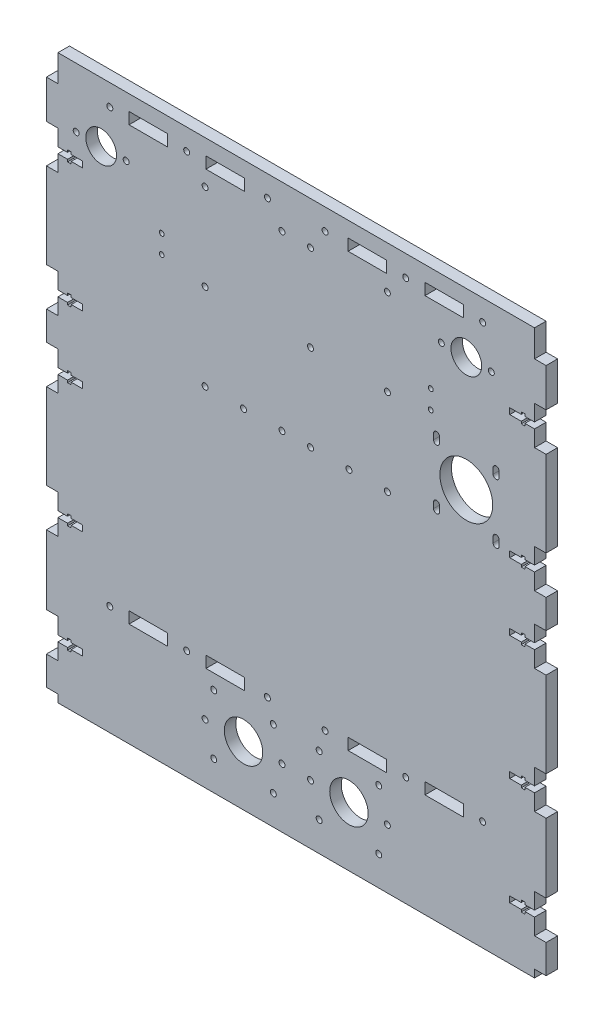
from build123d import *

# Parameters (mm, degrees)
SKETCH1_W           = 260
SKETCH1_H           = 270
BOSS_EXTRUDE1_DEPTH = 6
SKETCH2_W           = 20
SKETCH2_H           = 6
CUT_EXTRUDE1_DEPTH  = 6
SKETCH3_W           = 6
SKETCH3_H           = 20
CUT_EXTRUDE2_DEPTH  = 10
SKETCH4_R           = 8
CUT_EXTRUDE3_DEPTH  = 10
SKETCH5_R           = 8
SKETCH5_R_2         = 1.55
CUT_EXTRUDE4_DEPTH  = 6
SKETCH6_W           = 260
SKETCH6_H           = 6
BOSS_EXTRUDE2_DEPTH = 5
SKETCH7_R           = 13.75
CUT_EXTRUDE5_DEPTH  = 16
CUT_EXTRUDE6_DEPTH  = 10
SKETCH9_R           = 1.55
CUT_EXTRUDE7_DEPTH  = 10
BOSS_EXTRUDE3_DEPTH = 6
SKETCH11_R          = 1.55
SKETCH11_R_2        = 10
CUT_EXTRUDE9_DEPTH  = 10
SKETCH13_W          = 248
SKETCH13_H          = 6
BOSS_EXTRUDE4_DEPTH = 14
SKETCH14_W          = 248
SKETCH14_H          = 6
BOSS_EXTRUDE5_DEPTH = 4
SKETCH15_R          = 1.55
SKETCH15_W          = 20
SKETCH15_H          = 6
CUT_EXTRUDE10_DEPTH = 10
SKETCH16_R          = 1.25
CUT_EXTRUDE11_DEPTH = 10


with BuildPart() as part:
    # Sketch1 → Boss-Extrude1 (new body)
    with BuildSketch(Plane.XY):
        with Locations((130, 135)):
            Rectangle(SKETCH1_W, SKETCH1_H)
    extrude(amount=BOSS_EXTRUDE1_DEPTH)

    # Sketch2 → Cut-Extrude1 (cut)
    with BuildSketch(Plane(origin=(0, 0, 0), x_dir=(-1, 0, 0), z_dir=(0, 0, -1))):
        with Locations((-207, 53)):
            Rectangle(SKETCH2_W, SKETCH2_H)
        with Locations((-167, 53)):
            Rectangle(SKETCH2_W, SKETCH2_H)
        with BuildLine():
            Line((-220, 0), (-40, 0))
            ThreePointArc((-40, 0), (-130, 10), (-220, 0))
        make_face()
        with Locations((-93, 53)):
            Rectangle(SKETCH2_W, SKETCH2_H)
        with Locations((-53, 53)):
            Rectangle(SKETCH2_W, SKETCH2_H)
    extrude(amount=-CUT_EXTRUDE1_DEPTH, mode=Mode.SUBTRACT)

    # Sketch3 → Cut-Extrude2 (cut)
    with BuildSketch(Plane(origin=(0, 0, 0), x_dir=(-1, 0, 0), z_dir=(0, 0, -1))):
        with Locations((-257, 245)):
            Rectangle(SKETCH3_W, SKETCH3_H)
        with Locations((-257, 25)):
            Rectangle(SKETCH3_W, SKETCH3_H)
        with Locations((-257, 81)):
            Rectangle(SKETCH3_W, SKETCH3_H)
        with Locations((-257, 145.5)):
            Rectangle(SKETCH3_W, SKETCH3_H)
        with Locations((-257, 180.5)):
            Rectangle(SKETCH3_W, SKETCH3_H)
        with Locations((-3, 245)):
            Rectangle(SKETCH3_W, SKETCH3_H)
        with Locations((-3, 180.5)):
            Rectangle(SKETCH3_W, SKETCH3_H)
        with Locations((-3, 145.5)):
            Rectangle(SKETCH3_W, SKETCH3_H)
        with Locations((-3, 81)):
            Rectangle(SKETCH3_W, SKETCH3_H)
        with Locations((-3, 25)):
            Rectangle(SKETCH3_W, SKETCH3_H)
    extrude(amount=-CUT_EXTRUDE2_DEPTH, mode=Mode.SUBTRACT)

    # Sketch4 → Cut-Extrude3 (cut)
    with BuildSketch(Plane.XY.offset(6)):
        with Locations((28.5, 258)):
            Circle(SKETCH4_R)
        with Locations((218.5, 258)):
            Circle(SKETCH4_R)
    extrude(amount=-CUT_EXTRUDE3_DEPTH, mode=Mode.SUBTRACT)

    # Sketch5 → Cut-Extrude4 (cut)
    with BuildSketch(Plane.XY.offset(6)):
        with Locations((28.5, 258)):
            Circle(SKETCH5_R)
        with Locations((15.5, 258)):
            Circle(SKETCH5_R_2)
        with Locations((41.5, 258)):
            Circle(SKETCH5_R_2)
        with Locations((218.5, 258)):
            Circle(SKETCH5_R)
        with Locations((205.5, 258)):
            Circle(SKETCH5_R_2)
        with Locations((231.5, 258)):
            Circle(SKETCH5_R_2)
    extrude(amount=-CUT_EXTRUDE4_DEPTH, mode=Mode.SUBTRACT)

    # Sketch6 → Boss-Extrude2 (add)
    with BuildSketch(Plane(origin=(0, 270, 0), x_dir=(1, 0, 0), z_dir=(0, 1, 0))):
        with Locations((130, -3)):
            Rectangle(SKETCH6_W, SKETCH6_H)
    extrude(amount=BOSS_EXTRUDE2_DEPTH)

    # Sketch7 → Cut-Extrude5 (cut)
    with BuildSketch(Plane.XY.offset(6)):
        with BuildLine():
            ThreePointArc((201.45, 212.25), (202.975387713, 210.70019542), (204.549218368, 212.200781632))
            ThreePointArc((204.549218368, 212.200781632), (204.54980458, 212.225387713), (204.55, 212.25))
            Line((204.55, 212.25), (204.55, 215.25))
            ThreePointArc((204.55, 215.25), (203, 216.8), (201.45, 215.25))
            Line((201.45, 215.25), (201.45, 212.25))
        make_face()
        with BuildLine():
            ThreePointArc((232.45, 212.25), (232.45019542, 212.225387713), (232.450781632, 212.200781632))
            ThreePointArc((232.450781632, 212.200781632), (234.024612287, 210.70019542), (235.55, 212.25))
            Line((235.55, 212.25), (235.55, 215.25))
            ThreePointArc((235.55, 215.25), (234, 216.8), (232.45, 215.25))
            Line((232.45, 215.25), (232.45, 212.25))
        make_face()
        with BuildLine():
            ThreePointArc((235.55, 184.25), (234.024612287, 185.79980458), (232.450781632, 184.299218368))
            ThreePointArc((232.450781632, 184.299218368), (232.45019542, 184.274612287), (232.45, 184.25))
            Line((232.45, 184.25), (232.45, 181.25))
            ThreePointArc((232.45, 181.25), (234, 179.7), (235.55, 181.25))
            Line((235.55, 181.25), (235.55, 184.25))
        make_face()
        with Locations((218.5, 198.25)):
            Circle(SKETCH7_R)
        with BuildLine():
            ThreePointArc((204.55, 184.25), (204.54980458, 184.274612287), (204.549218368, 184.299218368))
            ThreePointArc((204.549218368, 184.299218368), (202.975387713, 185.79980458), (201.45, 184.25))
            Line((201.45, 184.25), (201.45, 181.25))
            ThreePointArc((201.45, 181.25), (203, 179.7), (204.55, 181.25))
            Line((204.55, 181.25), (204.55, 184.25))
        make_face()
    extrude(amount=-CUT_EXTRUDE5_DEPTH, mode=Mode.SUBTRACT)

    # Sketch8 → Cut-Extrude6 (cut)
    with BuildSketch(Plane.XY.offset(6)):
        Polygon((12.9, 243.45), (12.9, 242.25), (11, 242.25), (11, 243.45), (6, 243.45), (6, 246.55), (11, 246.55), (11, 247.75), (12.9, 247.75), (12.9, 246.55), (18.9, 246.55), (18.9, 243.45), align=None)
        Polygon((12.9, 177.75), (12.9, 178.95), (18.9, 178.95), (18.9, 182.05), (12.9, 182.05), (12.9, 183.25), (11, 183.25), (11, 182.05), (6, 182.05), (6, 178.95), (11, 178.95), (11, 177.75), align=None)
        Polygon((12.9, 143.95), (12.9, 142.75), (11, 142.75), (11, 143.95), (6, 143.95), (6, 147.05), (11, 147.05), (11, 148.25), (12.9, 148.25), (12.9, 147.05), (18.9, 147.05), (18.9, 143.95), align=None)
        Polygon((12.9, 78.25), (12.9, 79.45), (18.9, 79.45), (18.9, 82.55), (12.9, 82.55), (12.9, 83.75), (11, 83.75), (11, 82.55), (6, 82.55), (6, 79.45), (11, 79.45), (11, 78.25), align=None)
        Polygon((12.9, 23.45), (12.9, 22.25), (11, 22.25), (11, 23.45), (6, 23.45), (6, 26.55), (11, 26.55), (11, 27.75), (12.9, 27.75), (12.9, 26.55), (18.9, 26.55), (18.9, 23.45), align=None)
        Polygon((247.1, 27.75), (247.1, 26.55), (241.1, 26.55), (241.1, 23.45), (247.1, 23.45), (247.1, 22.25), (249, 22.25), (249, 23.45), (254, 23.45), (254, 26.55), (249, 26.55), (249, 27.75), align=None)
        Polygon((247.1, 82.55), (247.1, 83.75), (249, 83.75), (249, 82.55), (254, 82.55), (254, 79.45), (249, 79.45), (249, 78.25), (247.1, 78.25), (247.1, 79.45), (241.1, 79.45), (241.1, 82.55), align=None)
        Polygon((247.1, 148.25), (247.1, 147.05), (241.1, 147.05), (241.1, 143.95), (247.1, 143.95), (247.1, 142.75), (249, 142.75), (249, 143.95), (254, 143.95), (254, 147.05), (249, 147.05), (249, 148.25), align=None)
        Polygon((247.1, 182.05), (247.1, 183.25), (249, 183.25), (249, 182.05), (254, 182.05), (254, 178.95), (249, 178.95), (249, 177.75), (247.1, 177.75), (247.1, 178.95), (241.1, 178.95), (241.1, 182.05), align=None)
        Polygon((247.1, 247.75), (247.1, 246.55), (241.1, 246.55), (241.1, 243.45), (247.1, 243.45), (247.1, 242.25), (249, 242.25), (249, 243.45), (254, 243.45), (254, 246.55), (249, 246.55), (249, 247.75), align=None)
    extrude(amount=-CUT_EXTRUDE6_DEPTH, mode=Mode.SUBTRACT)

    # Sketch9 → Cut-Extrude7 (cut)
    with BuildSketch(Plane.XY.offset(6)):
        with Locations((33, 53)):
            Circle(SKETCH9_R)
        with Locations((73, 53)):
            Circle(SKETCH9_R)
        with Locations((115, 53)):
            Circle(SKETCH9_R)
        with Locations((145, 53)):
            Circle(SKETCH9_R)
        with Locations((187, 53)):
            Circle(SKETCH9_R)
        with Locations((227, 53)):
            Circle(SKETCH9_R)
    extrude(amount=-CUT_EXTRUDE7_DEPTH, mode=Mode.SUBTRACT)

    # Sketch12 → Boss-Extrude3 (add)
    with BuildSketch(Plane.XY):
        with BuildLine():
            Line((40, 0), (220, 0))
            ThreePointArc((220, 0), (130, 10), (40, 0))
        make_face()
    extrude(amount=BOSS_EXTRUDE3_DEPTH)

    # Sketch11 → Cut-Extrude9 (cut)
    with BuildSketch(Plane.XY):
        with Locations((177.42949686, 221.837864282)):
            Circle(SKETCH11_R)
        with Locations((177.42949686, 266.837864282)):
            Circle(SKETCH11_R)
        with Locations((157.42949686, 26.837864282)):
            Circle(SKETCH11_R_2)
        with Locations((137.428839649, 26.837864282)):
            Circle(SKETCH11_R)
        with Locations((141.93015407, 42.337864282)):
            Circle(SKETCH11_R)
        with Locations((141.93015407, 11.337864282)):
            Circle(SKETCH11_R)
        with Locations((172.928839649, 11.337864282)):
            Circle(SKETCH11_R)
        with Locations((172.928839649, 42.337864282)):
            Circle(SKETCH11_R)
        with Locations((177.43015407, 26.837864282)):
            Circle(SKETCH11_R)
        with Locations((177.42949686, 176.837864282)):
            Circle(SKETCH11_R)
        with Locations((157.42949686, 176.837864282)):
            Circle(SKETCH11_R)
        with Locations((137.42949686, 176.837864282)):
            Circle(SKETCH11_R)
        with Locations((137.42949686, 266.837864282)):
            Circle(SKETCH11_R)
        with Locations((137.42949686, 221.837864282)):
            Circle(SKETCH11_R)
        with Locations((122.57050314, 266.837864282)):
            Circle(SKETCH11_R)
        with Locations((122.57050314, 176.837864282)):
            Circle(SKETCH11_R)
        with Locations((102.57050314, 176.837864282)):
            Circle(SKETCH11_R)
        with Locations((82.57050314, 176.837864282)):
            Circle(SKETCH11_R)
        with Locations((82.56984593, 26.837864282)):
            Circle(SKETCH11_R)
        with Locations((87.071160351, 42.337864282)):
            Circle(SKETCH11_R)
        with Locations((87.071160351, 11.337864282)):
            Circle(SKETCH11_R)
        with Locations((118.06984593, 11.337864282)):
            Circle(SKETCH11_R)
        with Locations((118.06984593, 42.337864282)):
            Circle(SKETCH11_R)
        with Locations((122.571160351, 26.837864282)):
            Circle(SKETCH11_R)
        with Locations((102.57050314, 26.837864282)):
            Circle(SKETCH11_R_2)
        with Locations((82.57050314, 266.837864282)):
            Circle(SKETCH11_R)
        with Locations((82.57050314, 221.837864282)):
            Circle(SKETCH11_R)
    extrude(amount=CUT_EXTRUDE9_DEPTH, mode=Mode.SUBTRACT)

    # Sketch13 → Boss-Extrude4 (add)
    with BuildSketch(Plane(origin=(0, 275, 0), x_dir=(1, 0, 0), z_dir=(0, 1, 0))):
        with Locations((130, -3)):
            Rectangle(SKETCH13_W, SKETCH13_H)
    extrude(amount=BOSS_EXTRUDE4_DEPTH)

    # Sketch14 → Boss-Extrude5 (add)
    with BuildSketch(Plane.XZ):
        with Locations((130, 3)):
            Rectangle(SKETCH14_W, SKETCH14_H)
    extrude(amount=BOSS_EXTRUDE5_DEPTH)

    # Sketch15 → Cut-Extrude10 (cut)
    with BuildSketch(Plane.XY.offset(6)):
        with Locations((227, 53)):
            Circle(SKETCH15_R)
        with Locations((187, 53)):
            Circle(SKETCH15_R)
        with Locations((145, 53)):
            Circle(SKETCH15_R)
        with Locations((115, 53)):
            Circle(SKETCH15_R)
        with Locations((73, 53)):
            Circle(SKETCH15_R)
        with Locations((33, 53)):
            Circle(SKETCH15_R)
        with Locations((33, 278)):
            Circle(SKETCH15_R)
        with Locations((73, 278)):
            Circle(SKETCH15_R)
        with Locations((115, 278)):
            Circle(SKETCH15_R)
        with Locations((145, 278)):
            Circle(SKETCH15_R)
        with Locations((187, 278)):
            Circle(SKETCH15_R)
        with Locations((227, 278)):
            Circle(SKETCH15_R)
        with Locations((207, 53)):
            Rectangle(SKETCH15_W, SKETCH15_H)
        with Locations((167, 53)):
            Rectangle(SKETCH15_W, SKETCH15_H)
        with Locations((93, 53)):
            Rectangle(SKETCH15_W, SKETCH15_H)
        with Locations((53, 53)):
            Rectangle(SKETCH15_W, SKETCH15_H)
        with Locations((53, 278)):
            Rectangle(SKETCH15_W, SKETCH15_H)
        with Locations((93, 278)):
            Rectangle(SKETCH15_W, SKETCH15_H)
        with Locations((167, 278)):
            Rectangle(SKETCH15_W, SKETCH15_H)
        with Locations((207, 278)):
            Rectangle(SKETCH15_W, SKETCH15_H)
    extrude(amount=-CUT_EXTRUDE10_DEPTH, mode=Mode.SUBTRACT)

    # Sketch16 → Cut-Extrude11 (cut)
    with BuildSketch(Plane.XY.offset(6)):
        with Locations((60, 225)):
            Circle(SKETCH16_R)
        with Locations((60, 234.6)):
            Circle(SKETCH16_R)
        with Locations((200, 234.6)):
            Circle(SKETCH16_R)
        with Locations((200, 225)):
            Circle(SKETCH16_R)
    extrude(amount=-CUT_EXTRUDE11_DEPTH, mode=Mode.SUBTRACT)


solid = part.part
